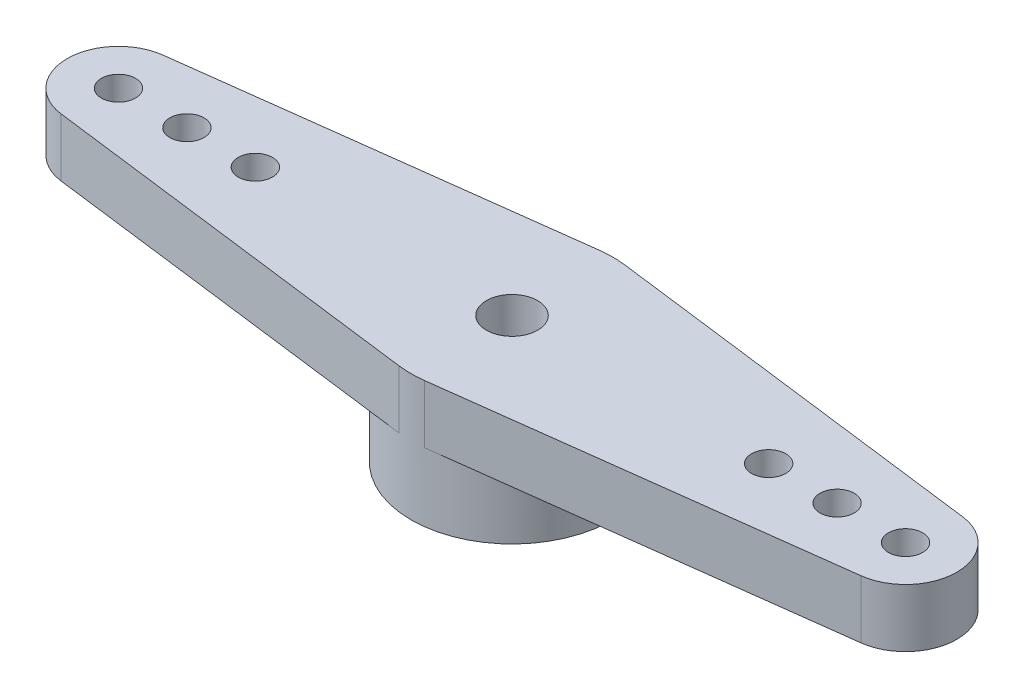
from build123d import *

# Parameters (mm, degrees)
SKETCH1_R           = 2.95
SKETCH1_R_2         = 1.9
BOSS_EXTRUDE1_DEPTH = 2
SKETCH2_R           = 0.5000000000000008
SKETCH2_R_2         = 0.75
BOSS_EXTRUDE2_DEPTH = 1.7


with BuildPart() as part:
    # Sketch1 → Boss-Extrude1 (new body)
    with BuildSketch(Plane(origin=(0, 0, 0), x_dir=(1, 0, 0), z_dir=(0, 1, 0))):
        with Locations(Location((0, 0, 0), (0, 0, 270))):
            Circle(SKETCH1_R)
        with Locations(Location((0, 0, 0), (0, 0, 270))):
            Circle(SKETCH1_R_2, mode=Mode.SUBTRACT)
    extrude(amount=BOSS_EXTRUDE1_DEPTH)

    # Sketch2 → Boss-Extrude2 (add)
    with BuildSketch(Plane(origin=(0, 2, 0), x_dir=(1, 0, 0), z_dir=(0, 1, 0))):
        with BuildLine():
            Line((-0.3719565217391307, 2.9264566195205663), (-11.689130434782609, 1.488028789586728))
            ThreePointArc((-11.689130434782609, 1.488028789586728), (-13, 1.8e-16), (-11.689130434782609, -1.488028789586728))
            Line((-11.689130434782609, -1.488028789586728), (-0.3719565217391307, -2.9264566195205663))
            ThreePointArc((-0.3719565217391307, -2.9264566195205663), (1.8e-16, -2.9500000000000024), (0.3719565217391307, -2.9264566195205663))
            Line((0.3719565217391307, -2.9264566195205663), (11.689130434782609, -1.488028789586728))
            ThreePointArc((11.689130434782609, -1.488028789586728), (13, 0), (11.689130434782609, 1.488028789586728))
            Line((11.689130434782609, 1.488028789586728), (0.3719565217391307, 2.9264566195205663))
            ThreePointArc((0.3719565217391307, 2.9264566195205663), (1.8e-16, 2.9500000000000024), (-0.3719565217391307, 2.9264566195205663))
        make_face()
        with Locations(Location((-11.5, 0, 0), (0, 0, 270))):
            Circle(SKETCH2_R, mode=Mode.SUBTRACT)
        with Locations(Location((-9.5, 0, 0), (0, 0, 270))):
            Circle(SKETCH2_R, mode=Mode.SUBTRACT)
        with Locations(Location((-7.5, 0, 0), (0, 0, 270))):
            Circle(SKETCH2_R, mode=Mode.SUBTRACT)
        with Locations(Location((7.5, 0, 0), (0, 0, 90))):
            Circle(SKETCH2_R, mode=Mode.SUBTRACT)
        with Locations(Location((9.5, 0, 0), (0, 0, 90))):
            Circle(SKETCH2_R, mode=Mode.SUBTRACT)
        with Locations(Location((11.5, 0, 0), (0, 0, 90))):
            Circle(SKETCH2_R, mode=Mode.SUBTRACT)
        with Locations(Location((0, 0, 0), (0, 0, 270))):
            Circle(SKETCH2_R_2, mode=Mode.SUBTRACT)
    extrude(amount=BOSS_EXTRUDE2_DEPTH)


solid = part.part
